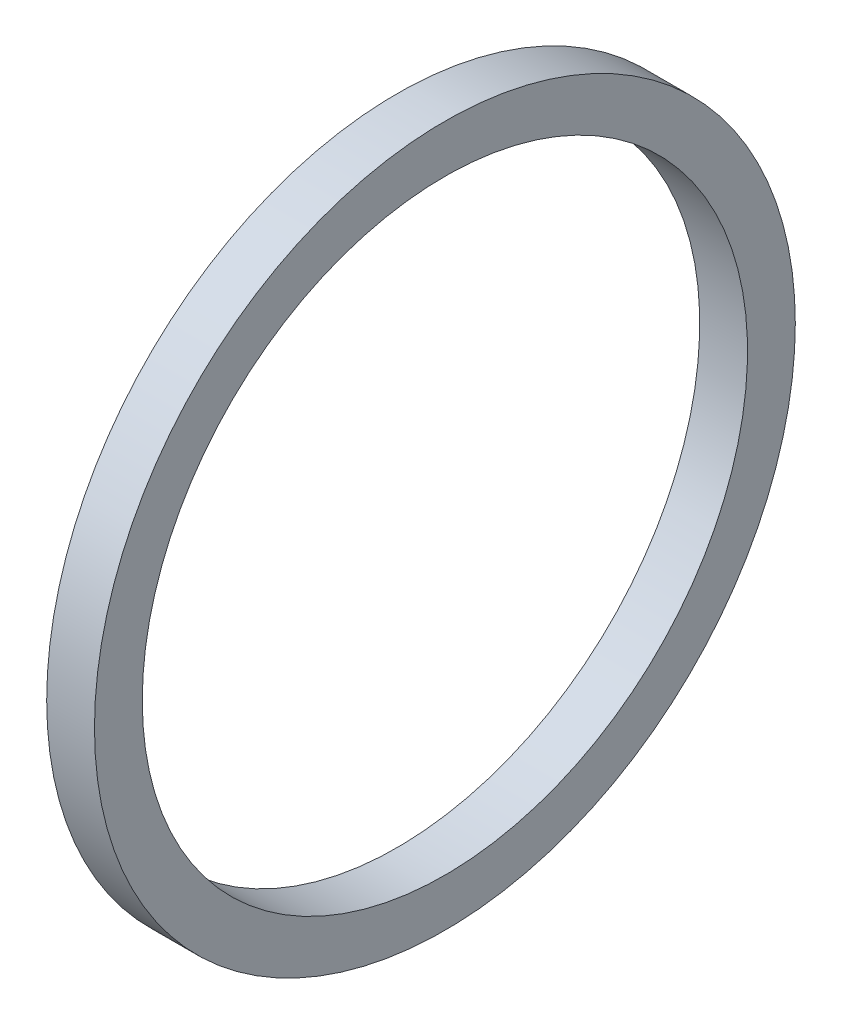
from build123d import *

# Parameters (mm, degrees)
SKETCH1_W = 3
SKETCH1_H = 3


with BuildPart() as part:
    # Sketch1 → Revolve1 (revolve)
    with BuildSketch(Plane(origin=(0, 0, 0), x_dir=(1, 0, 0), z_dir=(0, 1, 0)), mode=Mode.PRIVATE) as revolve1_sk:
        with Locations((0, 20.5)):
            Rectangle(SKETCH1_W, SKETCH1_H)
    revolve(revolve1_sk.sketch.rotate(Axis((0, 0, 0), (1, 0, 0)), 180), axis=Axis((0, 0, 0), (1, 0, 0)))


solid = part.part
